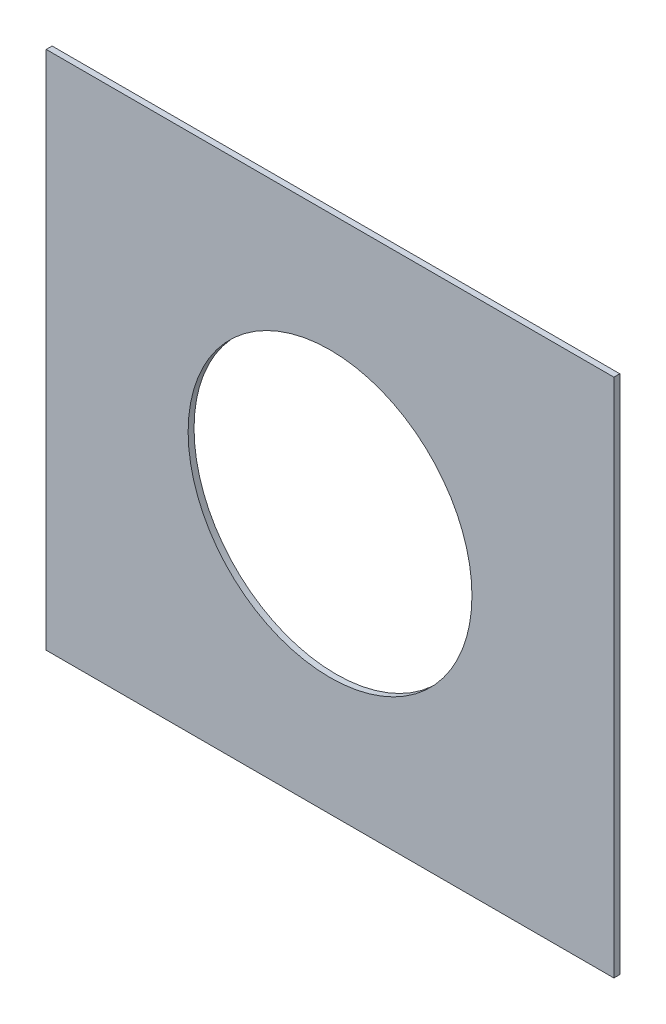
from build123d import *

# Parameters (mm, degrees)
SKETCH1_W           = 2400
SKETCH1_H           = 2200
BOSS_EXTRUDE1_DEPTH = 25
SKETCH2_R           = 600
CUT_EXTRUDE1_DEPTH  = 32


with BuildPart() as part:
    # Sketch1 → Boss-Extrude1 (new body)
    with BuildSketch(Plane.XY):
        Rectangle(SKETCH1_W, SKETCH1_H)
    extrude(amount=BOSS_EXTRUDE1_DEPTH)

    # Sketch2 → Cut-Extrude1 (cut)
    with BuildSketch(Plane.XY.offset(25)):
        Circle(SKETCH2_R)
    extrude(amount=-CUT_EXTRUDE1_DEPTH, mode=Mode.SUBTRACT)


solid = part.part
